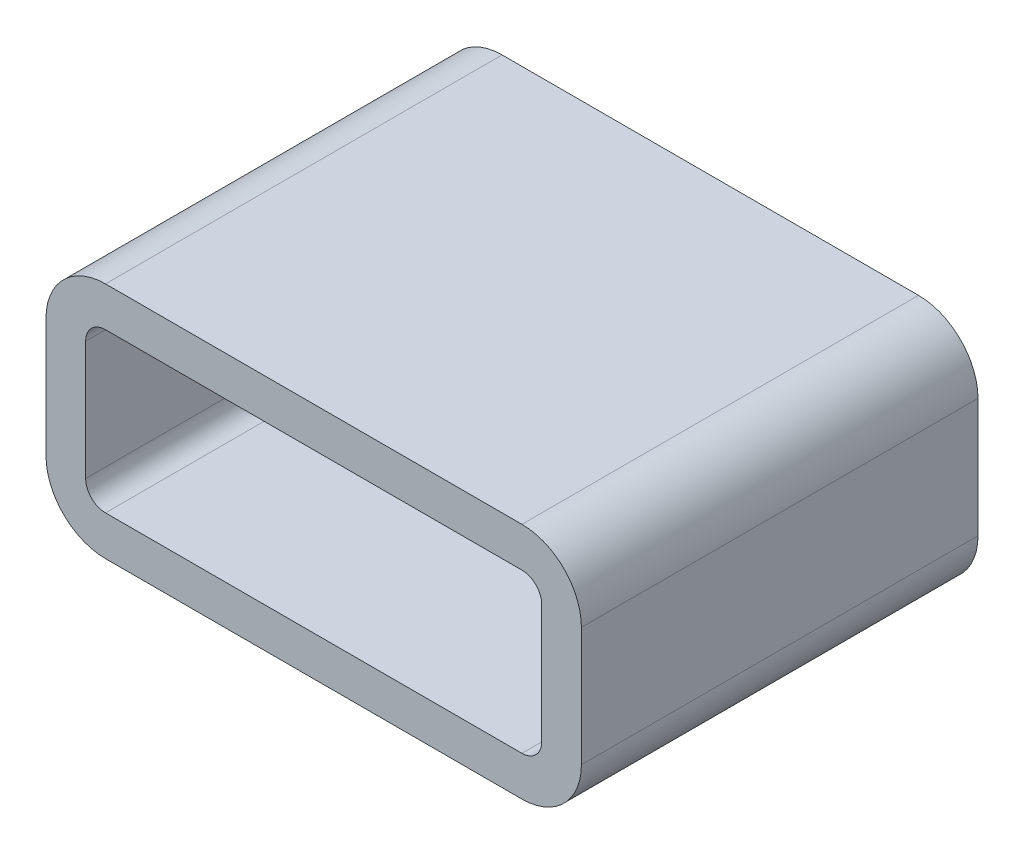
from build123d import *

# Parameters (mm, degrees)
CROQUIS1_W              = 27
CROQUIS1_H              = 12
SALIENTE_EXTRUIR1_DEPTH = 20
CROQUIS2_W              = 23
CROQUIS2_H              = 8
CORTAR_EXTRUIR1_DEPTH   = 20
REDONDEO1_R             = 3
REDONDEO2_R             = 1


with BuildPart() as part:
    # Croquis1 → Saliente-Extruir1 (new body)
    with BuildSketch(Plane.XY):
        Rectangle(CROQUIS1_W, CROQUIS1_H)
    extrude(amount=SALIENTE_EXTRUIR1_DEPTH)

    # Croquis2 → Cortar-Extruir1 (cut)
    with BuildSketch(Plane.XY.offset(20)):
        Rectangle(CROQUIS2_W, CROQUIS2_H)
    extrude(amount=-CORTAR_EXTRUIR1_DEPTH, mode=Mode.SUBTRACT)

    # Redondeo1
    redondeo1_edges = [part.edges().sort_by_distance(p)[0] for p in [
        (-13.5, 6, 10),
        (-13.5, -6, 10),
        (13.5, -6, 10),
        (13.5, 6, 10),
    ]]
    fillet(redondeo1_edges, radius=REDONDEO1_R)

    # Redondeo2
    redondeo2_edges = [part.edges().sort_by_distance(p)[0] for p in [
        (11.5, 4, 10),
        (11.5, -4, 10),
        (-11.5, -4, 10),
        (-11.5, 4, 10),
    ]]
    fillet(redondeo2_edges, radius=REDONDEO2_R)


solid = part.part
